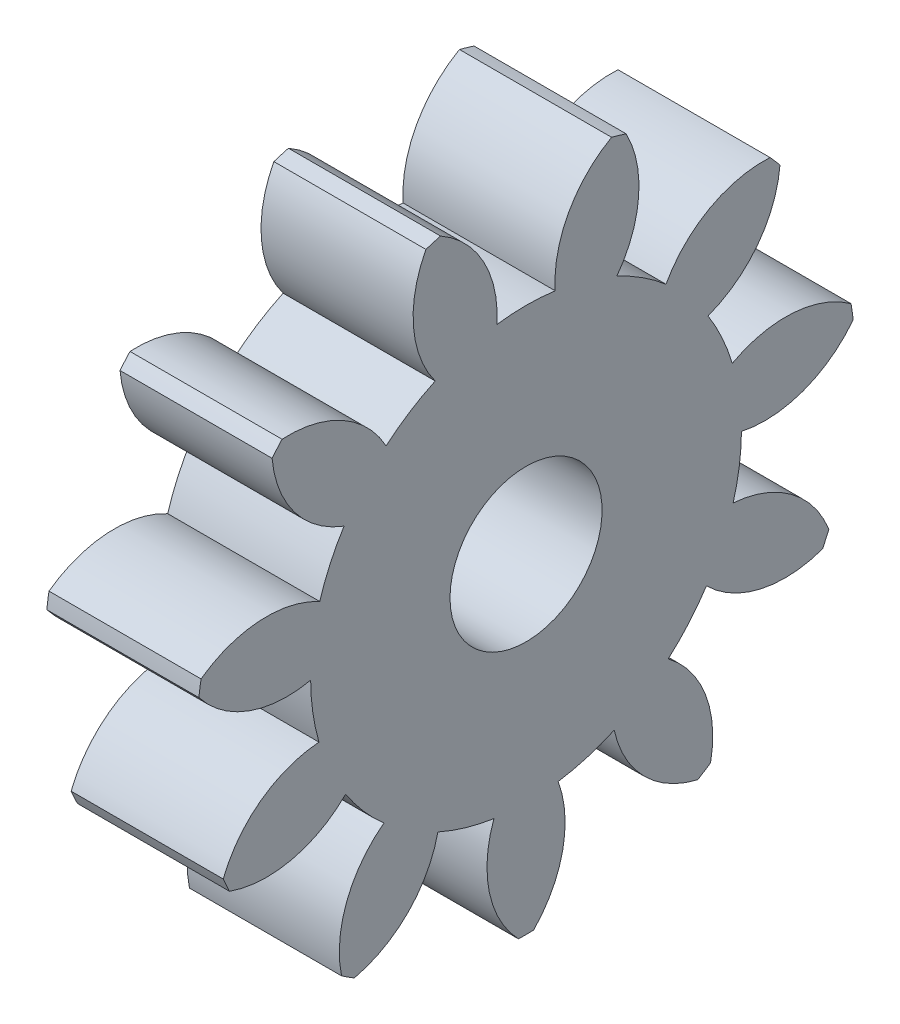
from build123d import *

# Parameters (mm, degrees)
BASPROSKE_W     = 3
BASPROSKE_H     = 6.5
TOOTHCUT_DEPTH  = 10.669539803
TEETHCUTS_COUNT = 11
TEETHCUTS_ANGLE = 327.272727273
BORSKE_R        = 1.5
BORE_DEPTH      = 50.0000508


with BuildPart() as part:
    # BasProSke → Base-Revolve (revolve)
    with BuildSketch(Plane(origin=(0, 0, 0), x_dir=(1, 0, 0), z_dir=(0, 1, 0)), mode=Mode.PRIVATE) as base_revolve_sk:
        with Locations((1.5, 3.25)):
            Rectangle(BASPROSKE_W, BASPROSKE_H)
    revolve(base_revolve_sk.sketch.rotate(Axis((-10, 0, 0), (1, 0, 0)), 180), axis=Axis((-10, 0, 0), (1, 0, 0)))

    # TooCutSke → ToothCut (cut, through all)
    with BuildSketch(Plane(origin=(0, 0, 0), x_dir=(0, 0, -1), z_dir=(1, 0, 0))):
        with BuildLine():
            ThreePointArc((0.576045815, 4.209771041), (0, 4.249), (-0.576045815, 4.209771041))
            ThreePointArc((-0.576045815, 4.209771041), (-0.841371334, 5.420048739), (-1.718652745, 6.295004202))
            ThreePointArc((-1.718652745, 6.295004202), (0, 6.5254), (1.718652745, 6.295004202))
            ThreePointArc((1.718652745, 6.295004202), (0.841371334, 5.420048739), (0.576045815, 4.209771041))
        make_face()
    toothcut = extrude(amount=TOOTHCUT_DEPTH, mode=Mode.SUBTRACT)

    # TeethCuts: ToothCut ×11 about axis
    teethcuts_axis = Axis((-10, 0, 0), (1, 0, 0))
    for i in range(1, TEETHCUTS_COUNT):
        add(toothcut.rotate(teethcuts_axis, i * TEETHCUTS_ANGLE / (TEETHCUTS_COUNT - 1)), mode=Mode.SUBTRACT)

    # BorSke → Bore (cut, symmetric)
    with BuildSketch(Plane(origin=(0, 0, 0), x_dir=(0, 0, -1), z_dir=(1, 0, 0))):
        with Locations(Location((0, 0, 0), (0, 0, 180))):
            Circle(BORSKE_R)
    extrude(amount=BORE_DEPTH, both=True, mode=Mode.SUBTRACT)


solid = part.part
